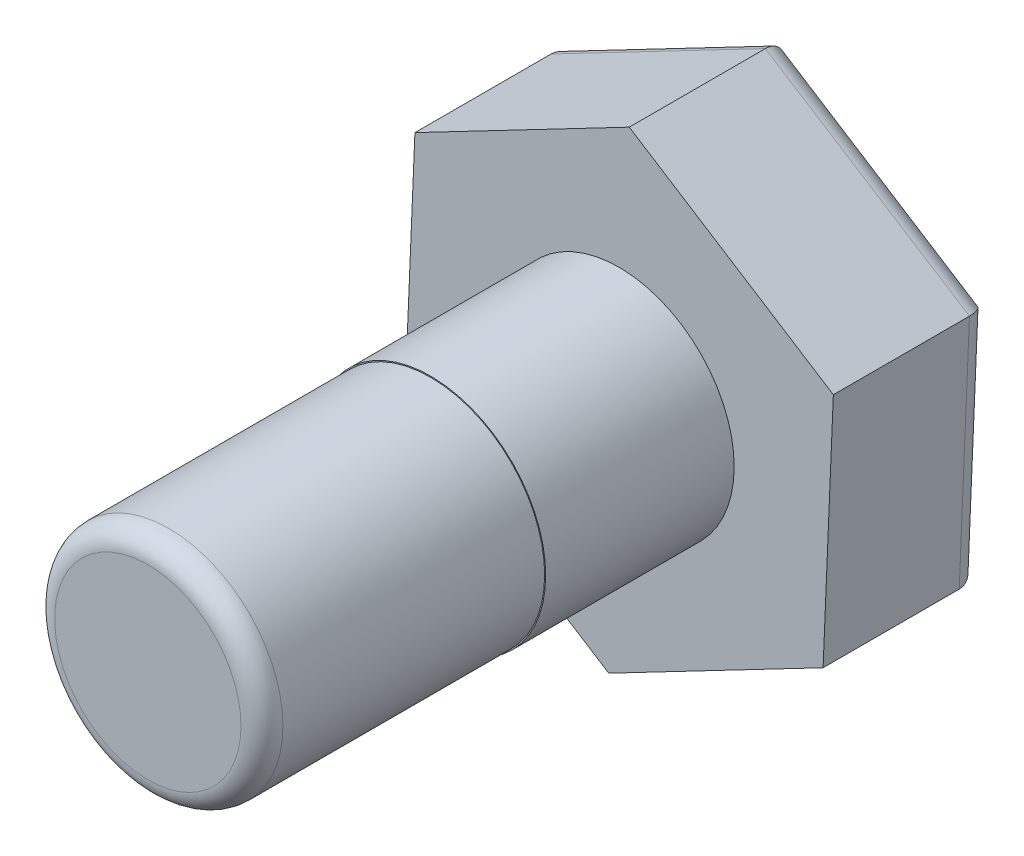
from build123d import *

# Parameters (mm, degrees)
EXTRUDE_397_DEPTH = 15
SKETCH_2_R        = 11
EXTRUDE_1_DEPTH   = 18
FILLET_3_R        = 2
SKETCH_3_R        = 10.9
EXTRUDE_1_2_DEPTH = 27
FILLET_4_R        = 2


with BuildPart() as part:
    # 草图1 → Extrude 397 (new body)
    with BuildSketch(Plane.XY):
        Polygon((20.472392036, 10.687118304), (0.980880074, 23.073170732), (-19.491511963, 12.386052428), (-20.472392036, -10.687118304), (-0.980880074, -23.073170732), (19.491511963, -12.386052428), align=None)
    extrude(amount=EXTRUDE_397_DEPTH)

    # 草图2 → Extrude 1 (add)
    with BuildSketch(Plane.XY.offset(15)):
        Circle(SKETCH_2_R)
    extrude(amount=EXTRUDE_1_DEPTH)

    # 圆角3
    fillet_3_edges = [part.edges().sort_by_distance(p)[0] for p in [
        (9.255315945, -17.72961158, 0),
        (-10.726636055, -16.880144518, 0),
        (-19.981952, 0.849467062, 0),
        (-9.255315945, 17.72961158, 0),
        (10.726636055, 16.880144518, 0),
        (19.981952, -0.849467062, 0),
    ]]
    fillet(fillet_3_edges, radius=FILLET_3_R)

    # 草图3 → Extrude 1 2 (add)
    with BuildSketch(Plane.XY.offset(33)):
        Circle(SKETCH_3_R)
    extrude(amount=EXTRUDE_1_2_DEPTH)

    # 圆角4
    fillet_4_edges = [part.edges().sort_by_distance(p)[0] for p in [
        (-10.9, 0, 60),
    ]]
    fillet(fillet_4_edges, radius=FILLET_4_R)


solid = part.part
